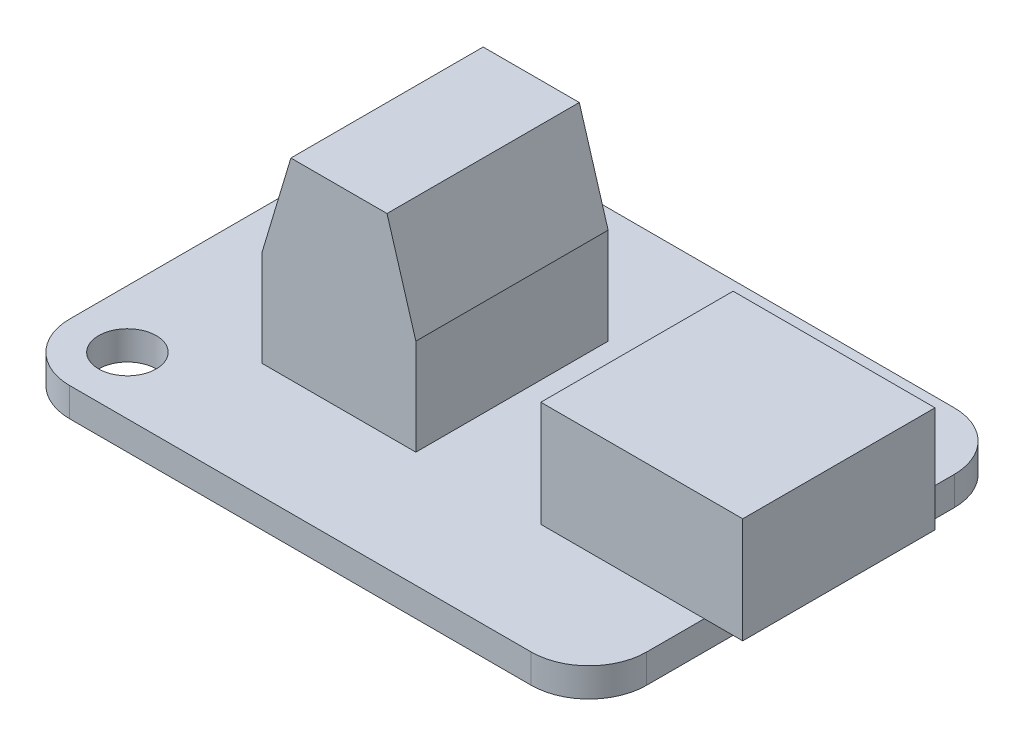
from build123d import *

# Parameters (mm, degrees)
SKETCH_1_R      = 1.5
EXTRUDE_1_DEPTH = 1.5
EXTRUDE_2_DEPTH = 5.5
SKETCH_3_W      = 8
SKETCH_3_H      = 10
EXTRUDE_3_DEPTH = 5
EXTRUDE_4_DEPTH = 10.000003


with BuildPart() as part:
    # Эскиз1 → Бобышка-Вытянуть1 (new body)
    with BuildSketch(Plane(origin=(0, 0, 0), x_dir=(1, 0, 0), z_dir=(0, 1, 0))):
        with BuildLine():
            Line((-28.198313686, 2.834587413), (-28.198313686, -13.165412587))
            ThreePointArc((-28.198313686, -13.165412587), (-27.31963403, -15.286732931), (-25.198313686, -16.165412587))
            Line((-25.198313686, -16.165412587), (-1.198313686, -16.165412587))
            ThreePointArc((-1.198313686, -16.165412587), (0.923006657, -15.286732931), (1.801686314, -13.165412587))
            Line((1.801686314, -13.165412587), (1.801686314, 2.834587413))
            ThreePointArc((1.801686314, 2.834587413), (0.923006657, 4.955907756), (-1.198313686, 5.834587413))
            Line((-1.198313686, 5.834587413), (-25.198313686, 5.834587413))
            ThreePointArc((-25.198313686, 5.834587413), (-27.31963403, 4.955907756), (-28.198313686, 2.834587413))
        make_face()
        with Locations(Location((-25.198313686, -13.165412587, 0), (0, 0, 270))):
            Circle(SKETCH_1_R, mode=Mode.SUBTRACT)
        with Locations(Location((-25.198313686, 2.834587413, 0), (0, 0, 270))):
            Circle(SKETCH_1_R, mode=Mode.SUBTRACT)
    extrude(amount=EXTRUDE_1_DEPTH)

    # Эскиз2 → Бобышка-Вытянуть2 (add)
    with BuildSketch(Plane(origin=(0, 1.5, 0), x_dir=(1, 0, 0), z_dir=(0, 1, 0))):
        Polygon((1.801686314, -0.165412587), (-6.698313686, -0.165412587), (-6.698313686, -10.165412587), (1.801686314, -10.165412587), (3.801686314, -10.165412587), (3.801686314, -0.165412587), align=None)
    extrude(amount=EXTRUDE_2_DEPTH)

    # Эскиз3 → Бобышка-Вытянуть3 (add)
    with BuildSketch(Plane(origin=(0, 1.5, 0), x_dir=(1, 0, 0), z_dir=(0, 1, 0))):
        with Locations((-17.198313686, -5.165412587)):
            Rectangle(SKETCH_3_W, SKETCH_3_H)
    extrude(amount=EXTRUDE_3_DEPTH)

    # Эскиз4 → Бобышка-Вытянуть4 (add)
    with BuildSketch(Plane.XY.offset(10.165412587)):
        Polygon((-21.198313686, 6.5), (-17.198313686, 6.5), (-17.198313686, 11.5), (-19.698313686, 11.5), align=None)
        Polygon((-17.198313686, 11.5), (-17.198313686, 6.5), (-13.198313686, 6.5), (-14.698313686, 11.5), align=None)
    extrude(amount=-EXTRUDE_4_DEPTH)


solid = part.part
